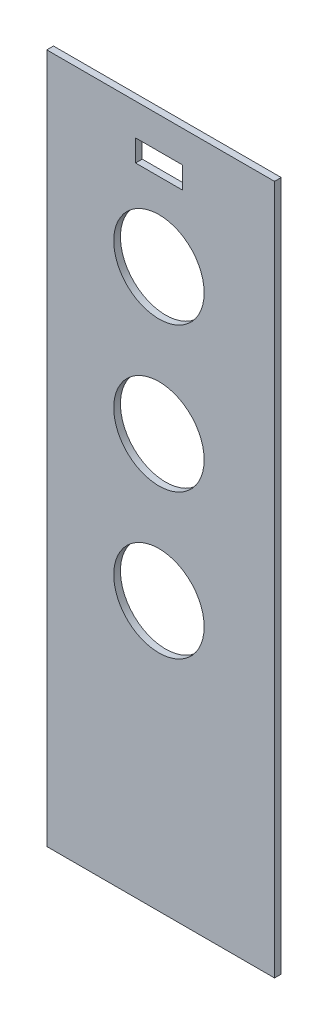
from build123d import *

# Parameters (mm, degrees)
SKETCH1_W           = 34
SKETCH1_H           = 103
BOSS_EXTRUDE1_DEPTH = 0.5
SKETCH3_R           = 6.75
SKETCH3_W           = 7
SKETCH3_H           = 3.25
CUT_EXTRUDE1_DEPTH  = 55.242511004


with BuildPart() as part:
    # Sketch1 → Boss-Extrude1 (new, symmetric)
    with BuildSketch(Plane.XY):
        Rectangle(SKETCH1_W, SKETCH1_H)
    extrude(amount=BOSS_EXTRUDE1_DEPTH, both=True)

    # Sketch3 → Cut-Extrude1 (cut, through all)
    with BuildSketch(Plane.XY.offset(0.5)):
        with Locations((-0.255791225, 31.827660642)):
            Circle(SKETCH3_R)
        with Locations((-0.255791225, 10.237617462)):
            Circle(SKETCH3_R)
        with Locations((-0.255791225, -11.352425718)):
            Circle(SKETCH3_R)
        with Locations((-0.25, 45.125)):
            Rectangle(SKETCH3_W, SKETCH3_H)
    extrude(amount=-CUT_EXTRUDE1_DEPTH, mode=Mode.SUBTRACT)


solid = part.part
